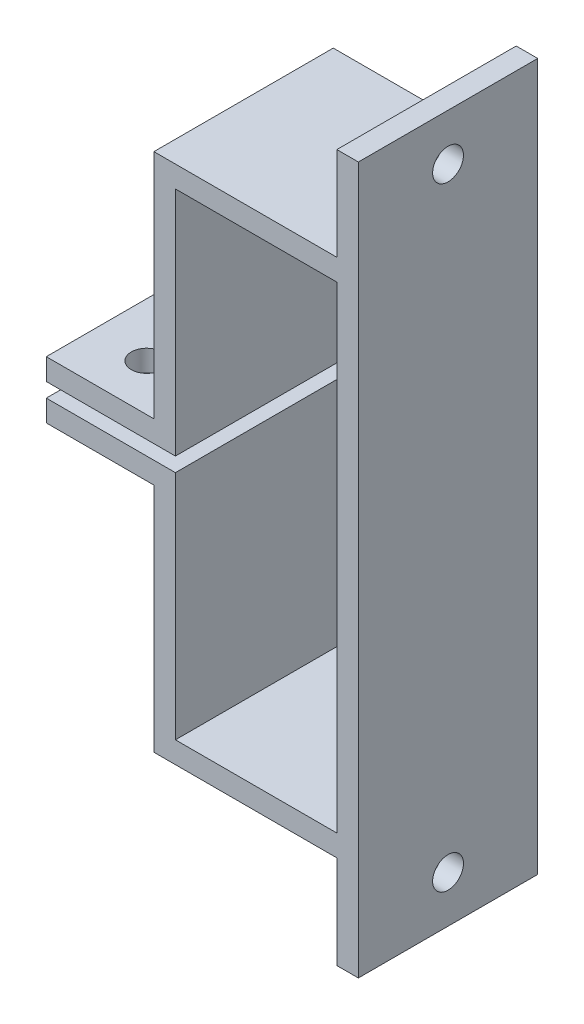
from build123d import *

# Parameters (mm, degrees)
BOSS_EXTRUDE1_DEPTH     = 25
SKETCH3_W               = 25
SKETCH3_H               = 13
BOSS_EXTRUDE2_DEPTH     = 3
SKETCH4_R               = 2.15
CUT_EXTRUDE1_DEPTH      = 3
CUT_EXTRUDE2_DEPTH      = 74.16291752
CUT_EXTRUDE2_DEPTH_BACK = 74.16291752
SKETCH5_R               = 2.15


with BuildPart() as part:
    # Sketch2 → Boss-Extrude1 (new body)
    with BuildSketch(Plane.XY):
        Polygon((0, 0), (0, -72.5), (-28.5, -72.5), (-28.5, -40.25), (-43.5, -40.25), (-43.5, -37.25), (-25.5, -37.25), (-25.5, -69.5), (-3, -69.5), (-3, -3), (-25.5, -3), (-25.5, -35.25), (-43.5, -35.25), (-43.5, -32.25), (-28.5, -32.25), (-28.5, 0), align=None)
    extrude(amount=BOSS_EXTRUDE1_DEPTH)

    # Sketch3 → Boss-Extrude2 (add)
    with BuildSketch(Plane(origin=(0, 0, 0), x_dir=(0, 0, -1), z_dir=(1, 0, 0))):
        with Locations((-12.5, 6.5)):
            Rectangle(SKETCH3_W, SKETCH3_H)
        with Locations((-12.5, -79)):
            Rectangle(SKETCH3_W, SKETCH3_H)
    extrude(amount=-BOSS_EXTRUDE2_DEPTH)

    # Sketch4 → Cut-Extrude1 (cut)
    with BuildSketch(Plane.ZY.offset(3)):
        with Locations(Location((12.5, 6.5, 0), (0, 0, 270))):
            Circle(SKETCH4_R)
        with Locations(Location((12.5, -79, 0), (0, 0, 270))):
            Circle(SKETCH4_R)
    extrude(amount=-CUT_EXTRUDE1_DEPTH, mode=Mode.SUBTRACT)

    # Sketch5 → Cut-Extrude2 (cut, two sides: drawn at the far end of the back side and taken through both)
    with BuildSketch(Plane(origin=(0, -32.25, 0), x_dir=(1, 0, 0), z_dir=(0, 1, 0)).offset(-CUT_EXTRUDE2_DEPTH_BACK)):
        with Locations(Location((-36, -6.5, 0), (0, 0, 270))):
            Circle(SKETCH5_R)
        with Locations(Location((-36, -18.5, 0), (0, 0, 270))):
            Circle(SKETCH5_R)
    extrude(amount=CUT_EXTRUDE2_DEPTH + CUT_EXTRUDE2_DEPTH_BACK, mode=Mode.SUBTRACT)


solid = part.part
